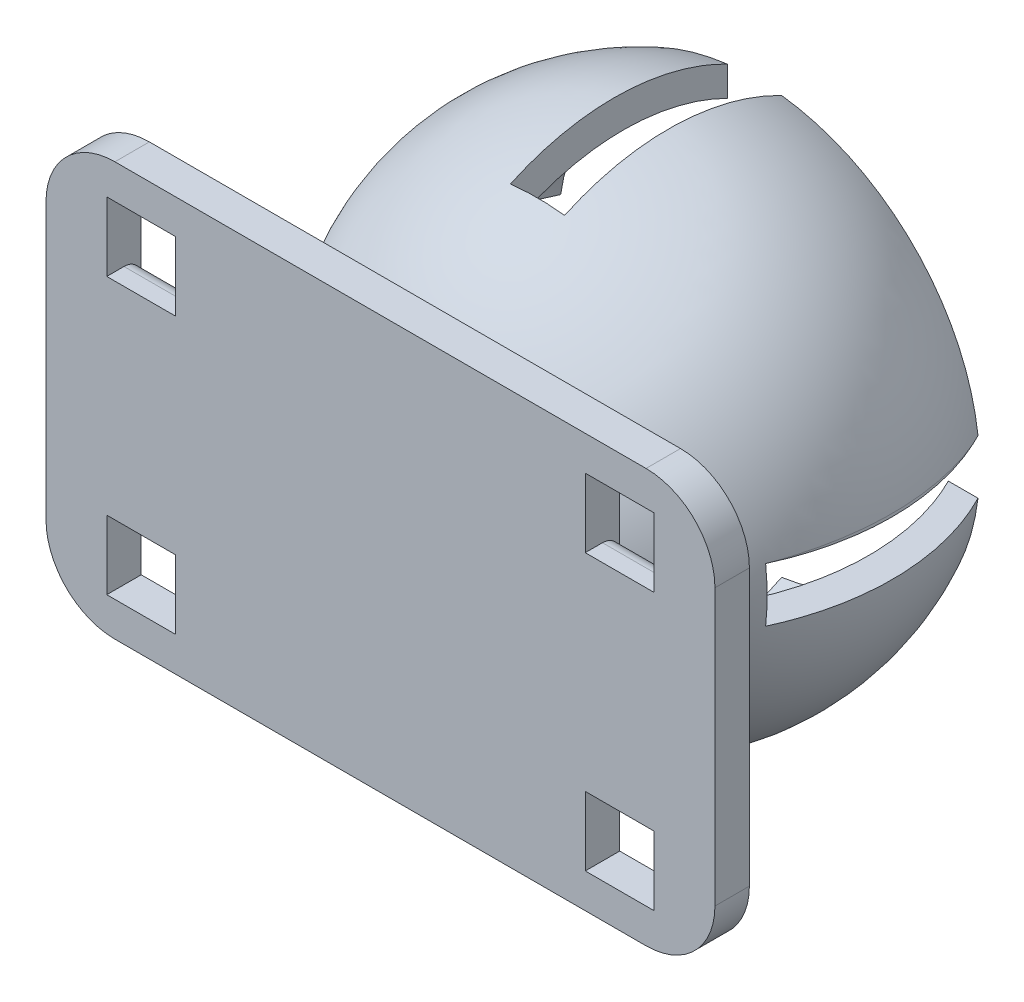
from build123d import *

# Parameters (mm, degrees)
BOSS_EXTRUDE1_START = 20
BOSS_EXTRUDE1_DEPTH = 3.175
CUT_EXTRUDE4_REACH  = 53.766
SKETCH4_W           = 6.35
SKETCH4_H           = 6.35
SKETCH2_W           = 5
SKETCH2_H           = 20
CUT_EXTRUDE5_DEPTH  = 33.274
CIRPATTERN3_COUNT   = 4
FILLET1_R           = 1.5875


with BuildPart() as part:
    # Sketch1 → Revolve2 (revolve)
    with BuildSketch(Plane(origin=(0, 0, 0), x_dir=(1, 0, 0), z_dir=(0, 1, 0))):
        with BuildLine():
            Line((0, -19.857956651), (0, -22))
            ThreePointArc((0, -22), (-19.810896108, -11.233150067), (-20.746710408, 11.295074756))
            Line((-20.746710408, 11.295074756), (-18.036546485, 11.295074756))
            ThreePointArc((-18.036546485, 11.295074756), (-17.383806908, -9.124800647), (0, -19.857956651))
        make_face()
    revolve(axis=Axis((0, 0, 22), (0, 0, -1)))

    # Sketch3 → Boss-Extrude1 (add)
    with BuildSketch(Plane.XY.offset(BOSS_EXTRUDE1_START)):
        with BuildLine():
            Line((-24.4729, -19.05), (24.4729, -19.05))
            ThreePointArc((24.4729, -19.05), (28.963028061, -17.190128061), (30.8229, -12.7))
            Line((30.8229, -12.7), (30.8229, 12.7))
            ThreePointArc((30.8229, 12.7), (28.963028061, 17.190128061), (24.4729, 19.05))
            Line((24.4729, 19.05), (-24.4729, 19.05))
            ThreePointArc((-24.4729, 19.05), (-28.963028061, 17.190128061), (-30.8229, 12.7))
            Line((-30.8229, 12.7), (-30.8229, -12.7))
            ThreePointArc((-30.8229, -12.7), (-28.963028061, -17.190128061), (-24.4729, -19.05))
        make_face()
    extrude(amount=BOSS_EXTRUDE1_DEPTH)

    # Sketch4 → Cut-Extrude4 (cut, up to next)
    with BuildSketch(Plane.XY.offset(23.175), mode=Mode.PRIVATE) as cut_extrude4_sk1:
        with Locations((-22.0472, 12.7)):
            Rectangle(SKETCH4_W, SKETCH4_H)
    cut_extrude4_tool1 = extrude(cut_extrude4_sk1.sketch, amount=-CUT_EXTRUDE4_REACH, mode=Mode.PRIVATE) & part.part
    # Sketch4 → Cut-Extrude4 (cut, up to next)
    with BuildSketch(Plane.XY.offset(23.175), mode=Mode.PRIVATE) as cut_extrude4_sk2:
        with Locations((-22.0472, -12.7)):
            Rectangle(SKETCH4_W, SKETCH4_H)
    cut_extrude4_tool2 = extrude(cut_extrude4_sk2.sketch, amount=-CUT_EXTRUDE4_REACH, mode=Mode.PRIVATE) & part.part
    # Sketch4 → Cut-Extrude4 (cut, up to next)
    with BuildSketch(Plane.XY.offset(23.175), mode=Mode.PRIVATE) as cut_extrude4_sk3:
        with Locations((22.0472, -12.7)):
            Rectangle(SKETCH4_W, SKETCH4_H)
    cut_extrude4_tool3 = extrude(cut_extrude4_sk3.sketch, amount=-CUT_EXTRUDE4_REACH, mode=Mode.PRIVATE) & part.part
    # Sketch4 → Cut-Extrude4 (cut, up to next)
    with BuildSketch(Plane.XY.offset(23.175), mode=Mode.PRIVATE) as cut_extrude4_sk4:
        with Locations((22.0472, 12.7)):
            Rectangle(SKETCH4_W, SKETCH4_H)
    cut_extrude4_tool4 = extrude(cut_extrude4_sk4.sketch, amount=-CUT_EXTRUDE4_REACH, mode=Mode.PRIVATE) & part.part
    add(cut_extrude4_tool1.solids().sort_by_distance((-22.0472, 12.7, 23.175))[0], mode=Mode.SUBTRACT)
    add(cut_extrude4_tool2.solids().sort_by_distance((-22.0472, -12.7, 23.175))[0], mode=Mode.SUBTRACT)
    add(cut_extrude4_tool3.solids().sort_by_distance((22.0472, -12.7, 23.175))[0], mode=Mode.SUBTRACT)
    add(cut_extrude4_tool4.solids().sort_by_distance((22.0472, 12.7, 23.175))[0], mode=Mode.SUBTRACT)

    # Sketch2 → Cut-Extrude5 (cut)
    with BuildSketch(Plane(origin=(0, 0, 0), x_dir=(1, 0, 0), z_dir=(0, 1, 0))):
        with Locations((0, 1.295074756)):
            Rectangle(SKETCH2_W, SKETCH2_H)
    cut_extrude5 = extrude(amount=-CUT_EXTRUDE5_DEPTH, mode=Mode.SUBTRACT)

    # CirPattern3: Cut-Extrude5 ×4 about axis
    cirpattern3_axis = Axis((0, 0, 0), (0, 0, 1))
    for i in range(1, CIRPATTERN3_COUNT):
        add(cut_extrude5.rotate(cirpattern3_axis, i * 360 / CIRPATTERN3_COUNT), mode=Mode.SUBTRACT)

    # Fillet1
    fillet1_edges = [part.edges().sort_by_distance(p)[0] for p in [
        (22.0472, 9.525, 20),
        (22.0472, -9.525, 20),
        (-22.0472, -9.525, 20),
        (-22.0472, 9.525, 20),
    ]]
    fillet(fillet1_edges, radius=FILLET1_R)


solid = part.part
